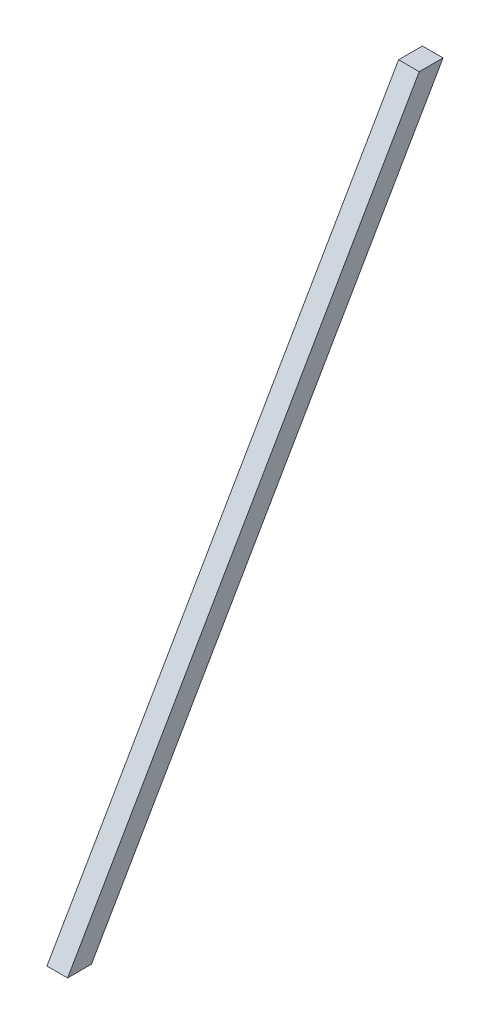
from build123d import *

# Parameters (mm, degrees)
BOSS_EXTRUDE1_DEPTH = 25.4


with BuildPart() as part:
    # Sketch1 → Boss-Extrude1 (new body)
    with BuildSketch(Plane(origin=(0, 0, 0), x_dir=(0, 0, -1), z_dir=(1, 0, 0))):
        Polygon((0, 0), (-29.329393675, 0), (403.279163029, 749.3), (432.608556704, 749.3), align=None)
    extrude(amount=BOSS_EXTRUDE1_DEPTH)


solid = part.part
